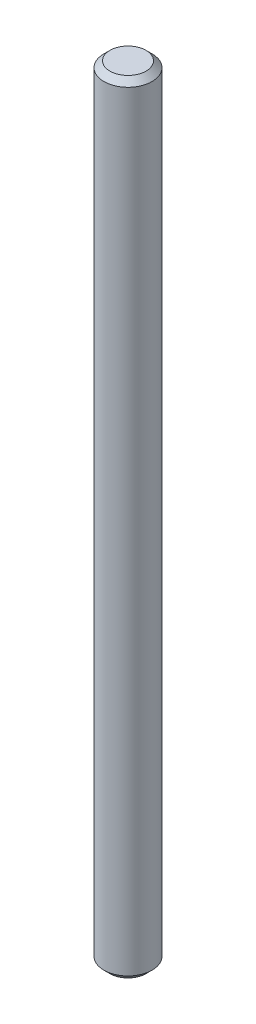
from build123d import *

# Parameters (mm, degrees)
SKETCH1_R           = 4
BOSS_EXTRUDE1_DEPTH = 65
CHAMFER1_SIZE       = 1


with BuildPart() as part:
    # Sketch1 → Boss-Extrude1 (new, symmetric)
    with BuildSketch(Plane(origin=(0, 0, 0), x_dir=(1, 0, 0), z_dir=(0, 1, 0))):
        with Locations(Location((0, 0, 0), (0, 0, 270))):
            Circle(SKETCH1_R)
    extrude(amount=BOSS_EXTRUDE1_DEPTH, both=True)

    # Chamfer1
    chamfer1_edges = [part.edges().sort_by_distance(p)[0] for p in [
        (0, -65, -4),
        (0, 65, -4),
    ]]
    chamfer(chamfer1_edges, length=CHAMFER1_SIZE)


solid = part.part
